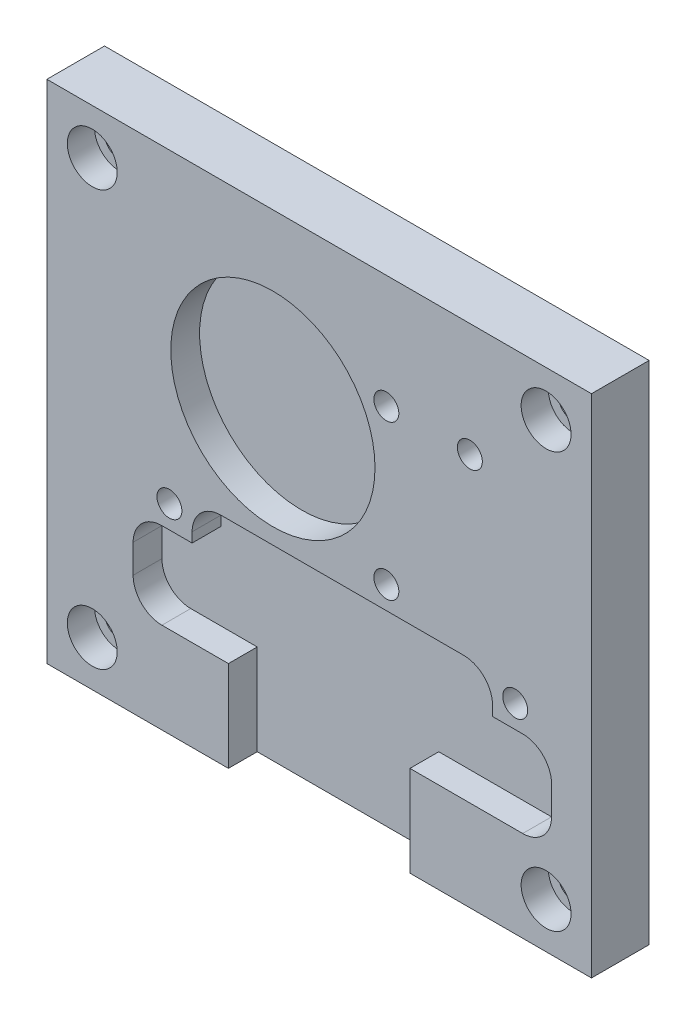
from build123d import *

# Parameters (mm, degrees)
SKETCH1_W                      = 120
SKETCH1_H                      = 111.5
BOSS_EXTRUDE1_DEPTH            = 12.7
SKETCH2_R                      = 22.5
CUT_EXTRUDE1_DEPTH             = 6.35
FILLET1_R                      = 6.35
CBORE_FOR_M5_SHCS1_D           = 5.5
CBORE_FOR_M5_SHCS1_CBORE_D     = 10
CBORE_FOR_M5_SHCS1_CBORE_DEPTH = 5
CBORE_FOR_M6_SHCS1_D           = 6.6
CBORE_FOR_M6_SHCS1_CBORE_D     = 11
CBORE_FOR_M6_SHCS1_CBORE_DEPTH = 6


with BuildPart() as part:
    # Sketch1 → Boss-Extrude1 (new body)
    with BuildSketch(Plane.XY):
        Rectangle(SKETCH1_W, SKETCH1_H)
    extrude(amount=BOSS_EXTRUDE1_DEPTH)

    # Sketch2 → Cut-Extrude1 (cut)
    with BuildSketch(Plane.XY.offset(12.7)):
        with Locations((-10.2, 17.75)):
            Circle(SKETCH2_R)
        Polygon((38.2, -8.25), (38.2, -16.75), (51.2, -16.75), (51.2, -35.75), (38.2, -35.75), (20, -35.75), (20, -55.75), (-20, -55.75), (-20, -35.75), (-28, -35.75), (-41, -35.75), (-41, -16.75), (-28, -16.75), (-28, -8.25), align=None)
    extrude(amount=-CUT_EXTRUDE1_DEPTH, mode=Mode.SUBTRACT)

    # Fillet1
    fillet1_edges = [part.edges().sort_by_distance(p)[0] for p in [
        (-28, -8.25, 9.525),
        (38.2, -8.25, 9.525),
        (51.2, -16.75, 9.525),
        (51.2, -35.75, 9.525),
        (-41, -35.75, 9.525),
        (-41, -16.75, 9.525),
    ]]
    fillet(fillet1_edges, radius=FILLET1_R)

    # CBORE for M5 SHCS1 (through all)
    with Locations(Plane(origin=(0, 0, 0), x_dir=(-1, 0, 0), z_dir=(0, 0, -1))):
        with Locations((-33.2, 30.75), (-14.8, 30.75), (-14.8, -3.25), (-43.2, -11.75), (33, -11.75)):
            CounterBoreHole(CBORE_FOR_M5_SHCS1_D / 2, CBORE_FOR_M5_SHCS1_CBORE_D / 2, CBORE_FOR_M5_SHCS1_CBORE_DEPTH)

    # CBORE for M6 SHCS1 (through all)
    with Locations(Plane.XY.offset(12.7)):
        with Locations((-50, 45.75), (50, 45.75), (50, -45.75), (-50, -45.75)):
            CounterBoreHole(CBORE_FOR_M6_SHCS1_D / 2, CBORE_FOR_M6_SHCS1_CBORE_D / 2, CBORE_FOR_M6_SHCS1_CBORE_DEPTH)


solid = part.part
